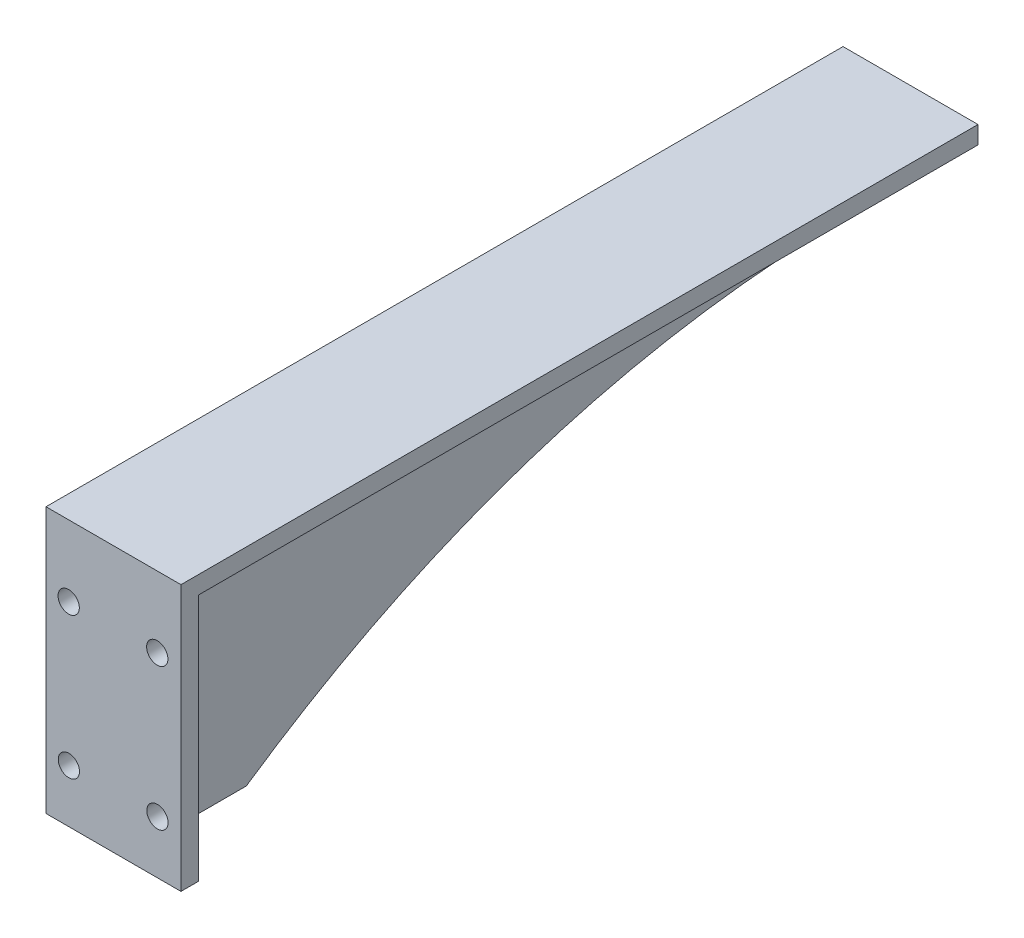
from build123d import *

# Parameters (mm, degrees)
SALIENTE_EXTRUIR1_DEPTH = 2.5
CROQUIS3_W              = 38.1
CROQUIS3_H              = 220
SALIENTE_EXTRUIR2_DEPTH = 5
CROQUIS4_W              = 38.1
CROQUIS4_H              = 75
SALIENTE_EXTRUIR3_DEPTH = 5
CROQUIS5_R              = 3
CORTAR_EXTRUIR1_DEPTH   = 5


with BuildPart() as part:
    # Croquis1 → Saliente-Extruir1 (new, symmetric)
    with BuildSketch(Plane(origin=(0, 0, 0), x_dir=(0, 0, -1), z_dir=(1, 0, 0))):
        with BuildLine():
            Line((0, 0), (220, 0))
            Line((220, 0), (220, -16))
            add(Edge.make_bspline(
                [(30, -70), (116.610221718, -10.835054956), (220, -16)],
                knots=[0, 0, 0, 1, 1, 1], degree=2))
            Line((30, -70), (0, -70))
            Line((0, -70), (0, 0))
        make_face()
    extrude(amount=SALIENTE_EXTRUIR1_DEPTH, both=True)

    # Croquis3 → Saliente-Extruir2 (add)
    with BuildSketch(Plane(origin=(0, 0, 0), x_dir=(1, 0, 0), z_dir=(0, 1, 0))):
        with Locations((0, 110)):
            Rectangle(CROQUIS3_W, CROQUIS3_H)
    extrude(amount=SALIENTE_EXTRUIR2_DEPTH)

    # Croquis4 → Saliente-Extruir3 (add)
    with BuildSketch(Plane.XY):
        with Locations((0, -32.5)):
            Rectangle(CROQUIS4_W, CROQUIS4_H)
    extrude(amount=SALIENTE_EXTRUIR3_DEPTH)

    # Croquis5 → Cortar-Extruir1 (cut)
    with BuildSketch(Plane.XY.offset(5)):
        with Locations((-12.645725933, -15.036309881)):
            Circle(CROQUIS5_R)
        with Locations((12.354274067, -15.036309881)):
            Circle(CROQUIS5_R)
        with Locations((-12.595015566, -55.036277737)):
            Circle(CROQUIS5_R)
        with Locations((12.404984434, -55.036277737)):
            Circle(CROQUIS5_R)
    extrude(amount=-CORTAR_EXTRUIR1_DEPTH, mode=Mode.SUBTRACT)


solid = part.part
